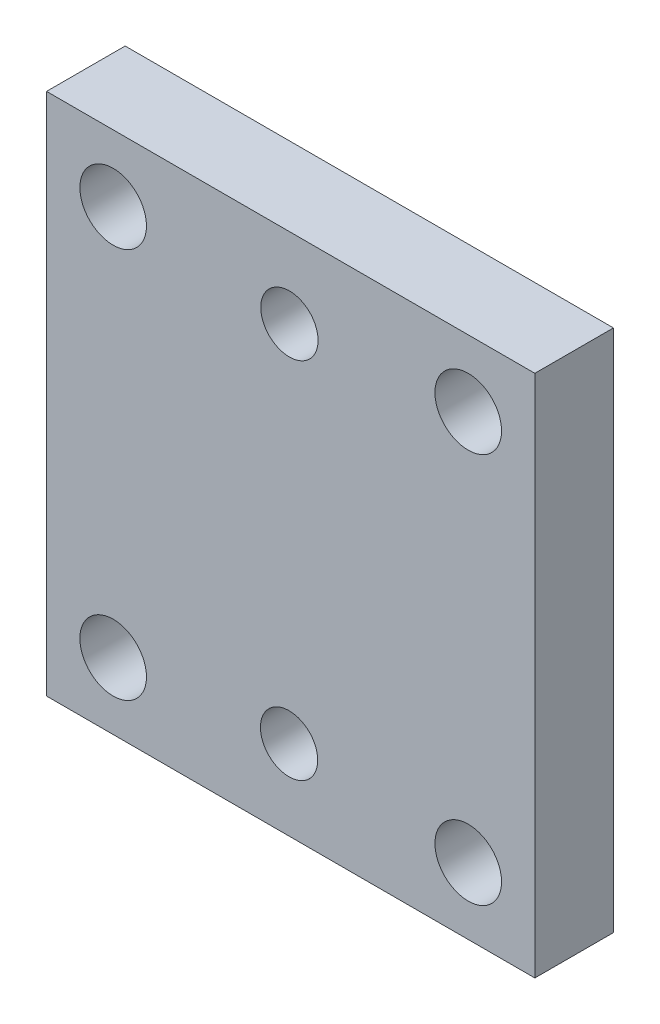
from build123d import *

# Parameters (mm, degrees)
SKETCH1_W           = 36.654989836
SKETCH1_H           = 39.3126
SKETCH1_R           = 2.15
BOSS_EXTRUDE1_DEPTH = 4
SKETCH2_W           = 36.654989836
SKETCH2_H           = 39.3126
BOSS_EXTRUDE2_DEPTH = 1.900000015
SKETCH3_R           = 2.5
CUT_EXTRUDE1_DEPTH  = 5.900000015
SKETCH4_W           = 8.8912
SKETCH4_H           = 11.10254
CUT_EXTRUDE2_DEPTH  = 3


with BuildPart() as part:
    # Sketch1 → Boss-Extrude1 (new body)
    with BuildSketch(Plane.XY):
        with Locations((-0.385705082, 0)):
            Rectangle(SKETCH1_W, SKETCH1_H)
        with Locations((-0.4826, 13.6525)):
            Circle(SKETCH1_R, mode=Mode.SUBTRACT)
        with Locations((-0.508, -13.6525)):
            Circle(SKETCH1_R, mode=Mode.SUBTRACT)
    extrude(amount=BOSS_EXTRUDE1_DEPTH)

    # Sketch2 → Boss-Extrude2 (add)
    with BuildSketch(Plane(origin=(0, 0, 0), x_dir=(-1, 0, 0), z_dir=(0, 0, -1))):
        with Locations((0.385705082, 0)):
            Rectangle(SKETCH2_W, SKETCH2_H)
        with BuildLine():
            Line((-17.1132, 10.4965), (-6.464885425, 10.4965))
            Line((-6.464885425, 10.4965), (-4.9212, 12.040185425))
            Line((-4.9212, 12.040185425), (-4.9212, 13.6525))
            ThreePointArc((-4.9212, 13.6525), (0.508, 19.0817), (5.9372, 13.6525))
            Line((5.9372, 13.6525), (5.9372, 12.040185425))
            Line((5.9372, 12.040185425), (7.480885425, 10.4965))
            Line((7.480885425, 10.4965), (17.1132, 10.4965))
            Line((17.1132, 10.4965), (17.1132, -0.0127))
            Line((17.1132, -0.0127), (17.105585288, -10.521897241))
            Line((17.105585288, -10.521897241), (7.473273242, -10.514917899))
            Line((7.473273242, -10.514917899), (5.928469705, -12.057484402))
            Line((5.928469705, -12.057484402), (5.927301461, -13.669798554))
            ThreePointArc((5.927301461, -13.669798554), (0.494169019, -19.095063262), (-4.931095689, -13.66193082))
            Line((-4.931095689, -13.66193082), (-4.929927445, -12.049616668))
            Line((-4.929927445, -12.049616668), (-6.472493947, -10.504813132))
            Line((-6.472493947, -10.504813132), (-17.120805727, -10.497097621))
            Line((-17.120805727, -10.497097621), (-17.1132, -0.000300188))
            Line((-17.1132, -0.000300188), (-17.1132, 10.4965))
        make_face(mode=Mode.SUBTRACT)
    extrude(amount=BOSS_EXTRUDE2_DEPTH)

    # Sketch3 → Cut-Extrude1 (cut)
    with BuildSketch(Plane(origin=(0, 0, -1.900000015), x_dir=(-1, 0, 0), z_dir=(0, 0, -1))):
        with Locations((-12.941789836, 14.6563)):
            Circle(SKETCH3_R)
        with Locations(Location((13.7132, 14.6563, 0), (0, 0, 180))):
            Circle(SKETCH3_R)
        with Locations((13.7132, -14.6563)):
            Circle(SKETCH3_R)
        with Locations(Location((-12.941789836, -14.6563, 0), (0, 0, 180))):
            Circle(SKETCH3_R)
    extrude(amount=-CUT_EXTRUDE1_DEPTH, mode=Mode.SUBTRACT)

    # Sketch4 → Cut-Extrude2 (cut)
    with BuildSketch(Plane(origin=(0, 0, 0), x_dir=(-1, 0, 0), z_dir=(0, 0, -1))):
        with Locations((12.2676, -0.28623)):
            Rectangle(SKETCH4_W, SKETCH4_H)
    extrude(amount=-CUT_EXTRUDE2_DEPTH, mode=Mode.SUBTRACT)


solid = part.part
